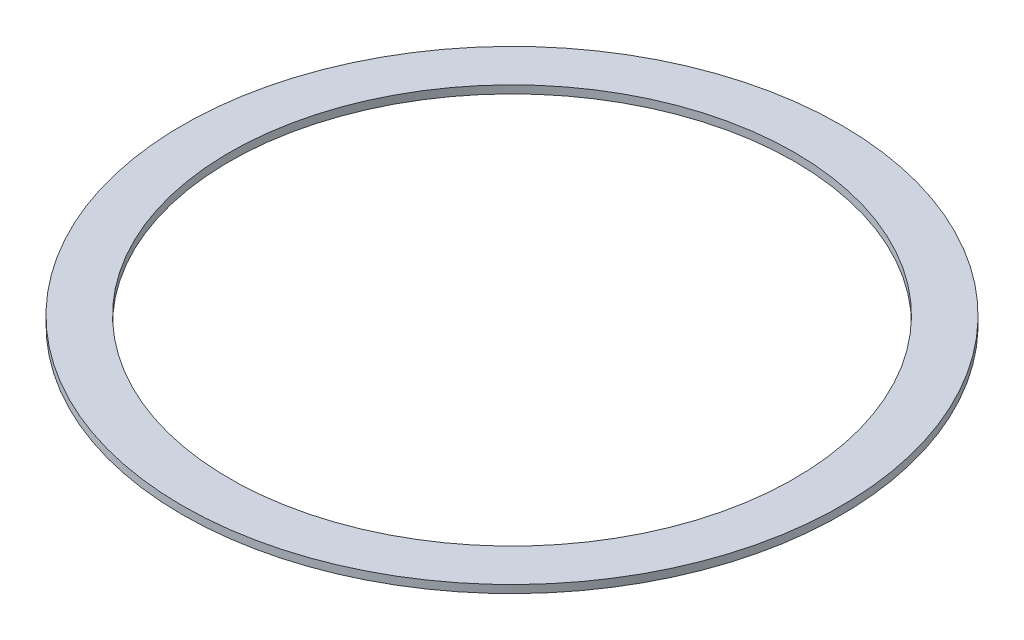
from build123d import *

# Parameters (mm, degrees)
ESBO_O1_W = 7.5
ESBO_O1_H = 1.25


with BuildPart() as part:
    # Esboço1 → Revolução1 (revolve)
    with BuildSketch(Plane.XY, mode=Mode.PRIVATE) as revolu_o1_sk:
        with Locations((20.123630265, -3.023471961)):
            Rectangle(ESBO_O1_W, ESBO_O1_H)
    revolve(revolu_o1_sk.sketch.rotate(Axis((-28.626369735, -36.039784007, 0), (0, 1, 0)), 90), axis=Axis((-28.626369735, -36.039784007, 0), (0, 1, 0)))


solid = part.part
